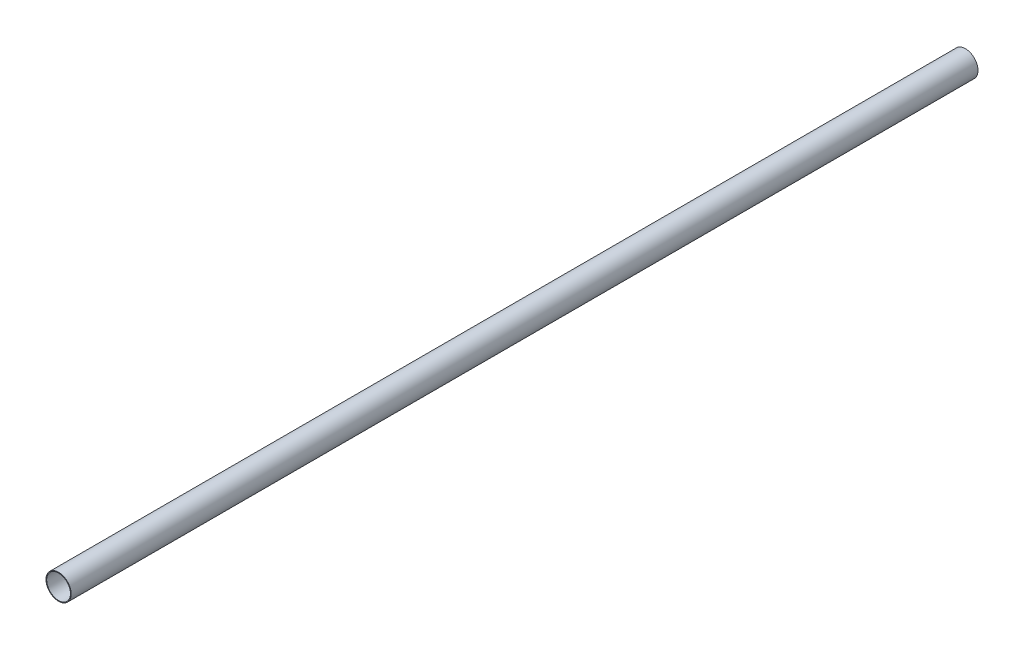
from build123d import *

# Parameters (mm, degrees)
SKETCH2_R           = 12.7
SKETCH2_R_2         = 11.9888
BOSS_EXTRUDE1_DEPTH = 457.2


with BuildPart() as part:
    # Sketch2 → Boss-Extrude1 (new, symmetric)
    with BuildSketch(Plane.XY):
        Circle(SKETCH2_R)
        Circle(SKETCH2_R_2, mode=Mode.SUBTRACT)
    extrude(amount=BOSS_EXTRUDE1_DEPTH, both=True)


solid = part.part
